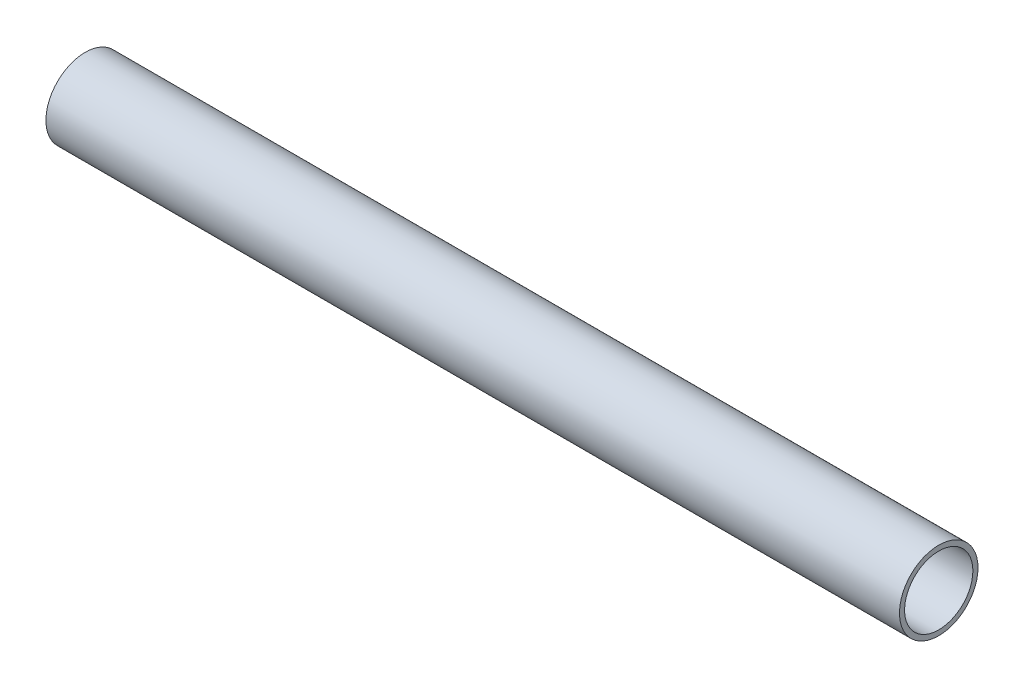
from build123d import *

# Parameters (mm, degrees)
SKETCH1_R           = 11.5
SKETCH1_R_2         = 10
EXTRUDE_THIN1_DEPTH = 250


with BuildPart() as part:
    # Sketch1 → Extrude-Thin1 (new body)
    with BuildSketch(Plane(origin=(0, 0, 0), x_dir=(0, 0, -1), z_dir=(1, 0, 0))):
        Circle(SKETCH1_R)
        Circle(SKETCH1_R_2, mode=Mode.SUBTRACT)
    extrude(amount=EXTRUDE_THIN1_DEPTH)


solid = part.part
